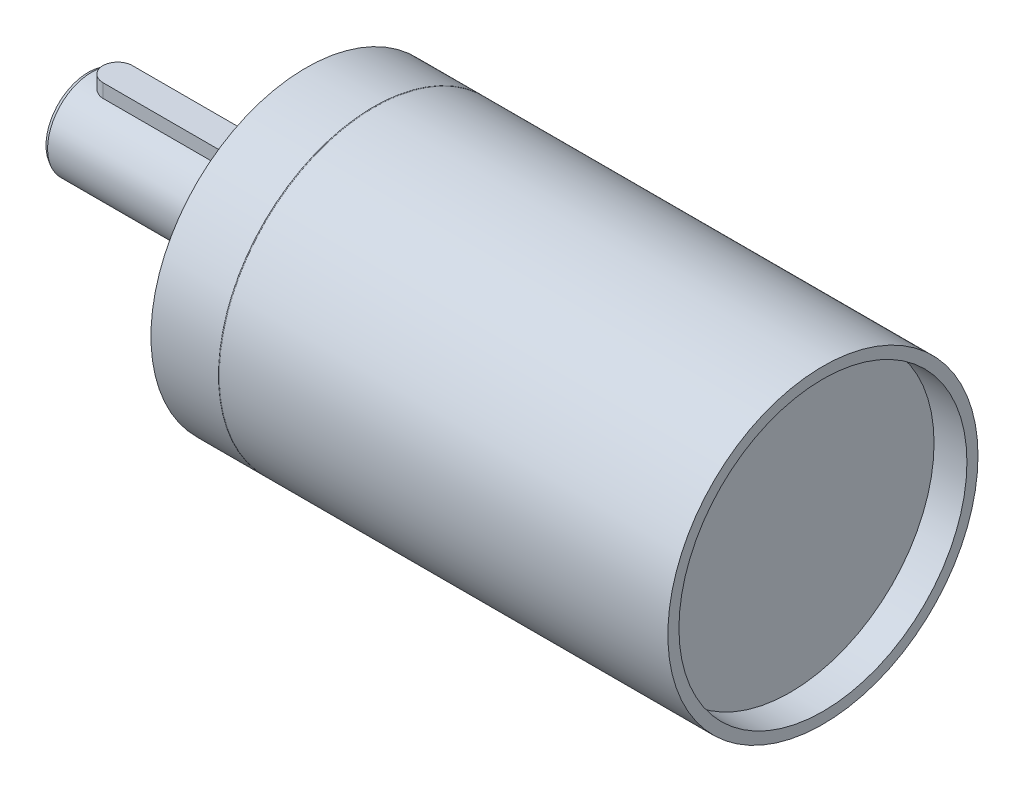
from build123d import *

# Parameters (mm, degrees)
SKETCH2_R                              = 14
BOSS_EXTRUDE1_DEPTH                    = 3
SKETCH3_R                              = 6
BOSS_EXTRUDE2_DEPTH                    = 26.5
BOSS_EXTRUDE3_DEPTH                    = 1
BOSS_EXTRUDE4_REACH                    = 80.443
BOSS_EXTRUDE4_END_RADIUS               = 6
M36_CLEARANCE_HOLE1_D                  = 39
M36_CLEARANCE_HOLE1_DEPTH              = 4.45
F_1_5_1_5_DIAMETER_HOLE1_D             = 1.5
F_1_5_1_5_DIAMETER_HOLE1_DEPTH         = 2
F_1_5_1_5_DIAMETER_HOLE1_TIP           = 0.450645464
F_3_3_3_3_DIAMETER_HOLE1_D             = 3.3
F_3_3_3_3_DIAMETER_HOLE1_DEPTH         = 6
F_3_3_3_3_DIAMETER_HOLE1_TIP           = 0.991420021
F_1_25_1_25_DIAMETER_HOLE1_D           = 1.25
F_1_25_1_25_DIAMETER_HOLE1_DEPTH       = 1.939156082
F_1_25_1_25_DIAMETER_HOLE1_CSINK_D     = 2.65
F_1_25_1_25_DIAMETER_HOLE1_CSINK_ANGLE = 60
F_1_25_1_25_DIAMETER_HOLE1_TIP         = 0.360843918
CHAMFER1_SIZE                          = 0.288675135
CHAMFER1_SIZE2                         = 0.5


with BuildPart() as part:
    # Sketch1 → Revolve1 (revolve)
    with BuildSketch(Plane.XY, mode=Mode.PRIVATE) as revolve1_sk:
        with BuildLine():
            Line((0, 21), (0, 0))
            Line((0, 0), (70, 0))
            Line((70, 0), (70, 21))
            Line((70, 21), (9.25, 21))
            ThreePointArc((9.25, 21), (9.2, 20.98660254), (9.15, 21))
            Line((9.15, 21), (0, 21))
        make_face()
    revolve(revolve1_sk.sketch.rotate(Axis((0, 0, 0), (1, 0, 0)), 270), axis=Axis((0, 0, 0), (1, 0, 0)))

    # Sketch2 → Boss-Extrude1 (add)
    with BuildSketch(Plane.ZY):
        Circle(SKETCH2_R)
    extrude(amount=BOSS_EXTRUDE1_DEPTH)

    # Sketch3 → Boss-Extrude2 (add)
    with BuildSketch(Plane.ZY.offset(3)):
        Circle(SKETCH3_R)
    extrude(amount=BOSS_EXTRUDE2_DEPTH)

    # Sketch4 → Boss-Extrude3 (add)
    with BuildSketch(Plane.ZY.offset(3)):
        with BuildLine():
            Line((0.293916284, -7.616838781), (0.293916284, -5.992796778))
            ThreePointArc((0.293916284, -5.992796778), (0, 6), (-0.293916284, -5.992796778))
            Line((-0.293916284, -5.992796778), (-0.293916284, -7.616838781))
            ThreePointArc((-0.293916284, -7.616838781), (-1.755912185, -7.072113956), (-2.882513969, -5.992796778))
            ThreePointArc((-2.882513969, -5.992796778), (0, 6.65), (2.882513969, -5.992796778))
            ThreePointArc((2.882513969, -5.992796778), (1.821852016, -7.17721696), (0.293916284, -7.616838781))
        make_face()
    extrude(amount=BOSS_EXTRUDE3_DEPTH)

    # Boss-Extrude4: up to this cylinder (the profile starts outside it)
    boss_extrude4_end = Plane(origin=(-17.5, 0, 0), z_dir=(1, 0, 0)) * Cylinder(BOSS_EXTRUDE4_END_RADIUS, 173.886, mode=Mode.PRIVATE)
    # Sketch5 → Boss-Extrude4 (add, up to the surface)
    with BuildSketch(Plane(origin=(0, 7.5, 0), x_dir=(1, 0, 0), z_dir=(0, 1, 0)), mode=Mode.PRIVATE) as boss_extrude4_sk1:
        with BuildLine():
            Line((-9.5, 2), (-25.5, 2))
            ThreePointArc((-25.5, 2), (-27.5, 0), (-25.5, -2))
            Line((-25.5, -2), (-9.5, -2))
            ThreePointArc((-9.5, -2), (-7.5, 0), (-9.5, 2))
        make_face()
    boss_extrude4_tool1 = extrude(boss_extrude4_sk1.sketch, amount=-BOSS_EXTRUDE4_REACH, mode=Mode.PRIVATE) - boss_extrude4_end
    add(boss_extrude4_tool1.solids().sort_by_distance((-17.5, 7.5, 0))[0])

    # M36 Clearance Hole1
    with Locations(Plane(origin=(70, 0, 0), x_dir=(0, 0, -1), z_dir=(1, 0, 0))):
        with Locations((0, 0)):
            Hole(M36_CLEARANCE_HOLE1_D / 2, depth=M36_CLEARANCE_HOLE1_DEPTH)

    # Ø1.5 (1.5) Diameter Hole1
    with Locations(Plane.ZY):
        with Locations((-7.462326931, 18.015650884)):
            Hole(F_1_5_1_5_DIAMETER_HOLE1_D / 2, depth=F_1_5_1_5_DIAMETER_HOLE1_DEPTH)
            with Locations((0, 0, -(F_1_5_1_5_DIAMETER_HOLE1_DEPTH + F_1_5_1_5_DIAMETER_HOLE1_TIP / 2))):  # 118° drill point
                Cone(0, F_1_5_1_5_DIAMETER_HOLE1_D / 2, F_1_5_1_5_DIAMETER_HOLE1_TIP, mode=Mode.SUBTRACT)

    # Ø3.3 (3.3) Diameter Hole1
    with Locations(Plane.ZY):
        with Locations((3.0543e-05, 17.5), (17.5, -3.0543e-05), (-3.0543e-05, -17.5), (-17.5, 3.0543e-05)):
            Hole(F_3_3_3_3_DIAMETER_HOLE1_D / 2, depth=F_3_3_3_3_DIAMETER_HOLE1_DEPTH)
            with Locations((0, 0, -(F_3_3_3_3_DIAMETER_HOLE1_DEPTH + F_3_3_3_3_DIAMETER_HOLE1_TIP / 2))):  # 118° drill point
                Cone(0, F_3_3_3_3_DIAMETER_HOLE1_D / 2, F_3_3_3_3_DIAMETER_HOLE1_TIP, mode=Mode.SUBTRACT)

    # Ø1.25 (1.25) Diameter Hole1
    with Locations(Plane.ZY.offset(29.5)):
        with Locations((0, 0)):
            CounterSinkHole(F_1_25_1_25_DIAMETER_HOLE1_D / 2, F_1_25_1_25_DIAMETER_HOLE1_CSINK_D / 2, depth=F_1_25_1_25_DIAMETER_HOLE1_DEPTH, counter_sink_angle=F_1_25_1_25_DIAMETER_HOLE1_CSINK_ANGLE)
            with Locations((0, 0, -(F_1_25_1_25_DIAMETER_HOLE1_DEPTH + F_1_25_1_25_DIAMETER_HOLE1_TIP / 2))):  # 120° drill point
                Cone(0, F_1_25_1_25_DIAMETER_HOLE1_D / 2, F_1_25_1_25_DIAMETER_HOLE1_TIP, mode=Mode.SUBTRACT)

    # Chamfer1
    chamfer1_edges = [part.edges().sort_by_distance(p)[0] for p in [
        (-29.5, 0, -6),
    ]]
    chamfer1_side = [part.faces().sort_by_distance(p)[0] for p in [
        (-29.5, 0, -5.830294373),
    ]]
    chamfer(chamfer1_edges, length=CHAMFER1_SIZE, length2=CHAMFER1_SIZE2, reference=chamfer1_side[0])


solid = part.part
